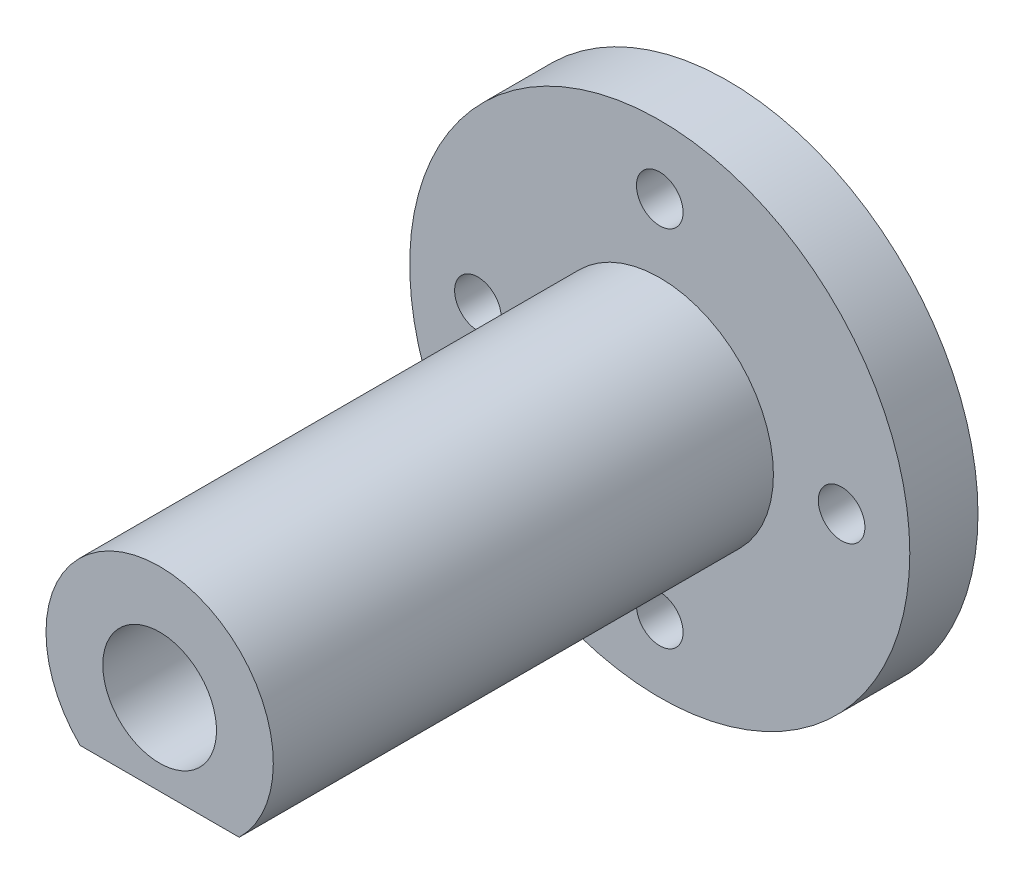
from build123d import *

# Parameters (mm, degrees)
SKETCH1_R           = 11
SKETCH1_R_2         = 1.025
SKETCH1_R_3         = 4.25
BOSS_EXTRUDE1_DEPTH = 3
SKETCH2_R           = 5
SKETCH2_R_2         = 2.5
BOSS_EXTRUDE2_DEPTH = 22
CUT_EXTRUDE1_START  = -10
CUT_EXTRUDE1_DEPTH  = 10


with BuildPart() as part:
    # Sketch1 → Boss-Extrude1 (new body)
    with BuildSketch(Plane(origin=(0, 0, 0), x_dir=(0, 1, 0), z_dir=(0, 0, 1))):
        with Locations(Location((0, 0, 0), (0, 0, 270))):
            Circle(SKETCH1_R)
        with Locations(Location((0, 8, 0), (0, 0, 270))):
            Circle(SKETCH1_R_2, mode=Mode.SUBTRACT)
        with Locations(Location((0, 0, 0), (0, 0, 270))):
            Circle(SKETCH1_R_3, mode=Mode.SUBTRACT)
        with Locations(Location((8, 0, 0), (0, 0, 270))):
            Circle(SKETCH1_R_2, mode=Mode.SUBTRACT)
        with Locations(Location((0, -8, 0), (0, 0, 270))):
            Circle(SKETCH1_R_2, mode=Mode.SUBTRACT)
        with Locations(Location((-8, 0, 0), (0, 0, 270))):
            Circle(SKETCH1_R_2, mode=Mode.SUBTRACT)
    extrude(amount=BOSS_EXTRUDE1_DEPTH)

    # Sketch2 → Boss-Extrude2 (add)
    with BuildSketch(Plane.XY.offset(3)):
        with Locations(Location((0, 0, 0), (0, 0, 180))):
            Circle(SKETCH2_R)
        with Locations(Location((0, 0, 0), (0, 0, 180))):
            Circle(SKETCH2_R_2, mode=Mode.SUBTRACT)
    extrude(amount=BOSS_EXTRUDE2_DEPTH)

    # Sketch3 → Cut-Extrude1 (cut)
    with BuildSketch(Plane.XY.offset(25).offset(CUT_EXTRUDE1_START)):
        with BuildLine():
            Line((3.5, -3.570714214), (-3.5, -3.570714214))
            ThreePointArc((-3.5, -3.570714214), (0, -5), (3.5, -3.570714214))
        make_face()
    extrude(amount=CUT_EXTRUDE1_DEPTH, mode=Mode.SUBTRACT)


solid = part.part
